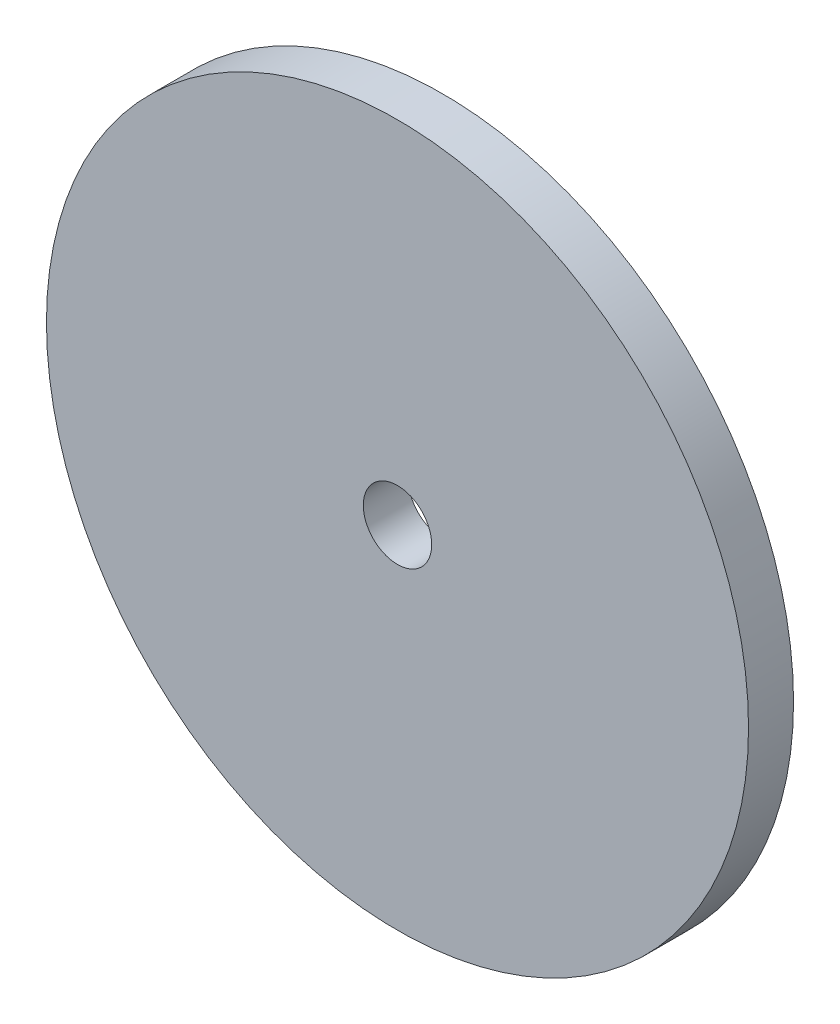
from build123d import *

# Parameters (mm, degrees)
SKETCH1_R           = 49.53
BOSS_EXTRUDE1_DEPTH = 6.35
SKETCH2_R           = 4.826
CUT_EXTRUDE1_DEPTH  = 6.35


with BuildPart() as part:
    # Sketch1 → Boss-Extrude1 (new body)
    with BuildSketch(Plane.XY):
        Circle(SKETCH1_R)
    extrude(amount=BOSS_EXTRUDE1_DEPTH)

    # Sketch2 → Cut-Extrude1 (cut)
    with BuildSketch(Plane(origin=(0, 0, 0), x_dir=(-1, 0, 0), z_dir=(0, 0, -1))):
        Circle(SKETCH2_R)
    extrude(amount=-CUT_EXTRUDE1_DEPTH, mode=Mode.SUBTRACT)


solid = part.part
